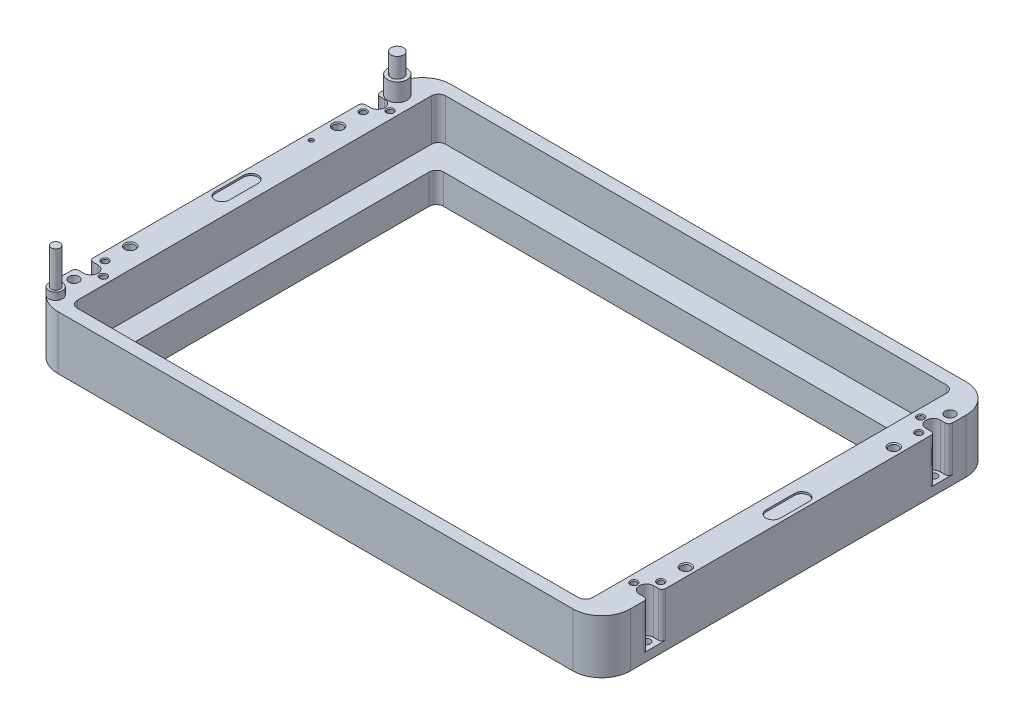
from build123d import *

# Parameters (mm, degrees)
SKETCH1_W                       = 159.7
SKETCH1_H                       = 109.7
SKETCH1_W_2                     = 130.9
SKETCH1_H_2                     = 88.7
BOSS_EXTRUDE1_DEPTH             = 20
SKETCH2_W                       = 143.7
SKETCH2_H                       = 102.7
SKETCH2_W_2                     = 130.9
SKETCH2_H_2                     = 88.7
CUT_EXTRUDE1_DEPTH              = 11.7
SKETCH3_W                       = 159.7
SKETCH3_H                       = 109.7
SKETCH3_W_2                     = 134.7
SKETCH3_H_2                     = 94.7
CUT_EXTRUDE2_DEPTH              = 5
FILLET1_R                       = 2
FILLET2_R                       = 8
M2X0_4_TAPPED_HOLE1_D           = 1.6
M2X0_4_TAPPED_HOLE1_DEPTH       = 3.5
M2X0_4_TAPPED_HOLE1_CSINK_D     = 2.05
M2X0_4_TAPPED_HOLE1_CSINK_ANGLE = 90
M2X0_4_TAPPED_HOLE1_TIP         = 0.480688495
SKETCH7_R                       = 2.7
BOSS_EXTRUDE2_DEPTH             = 5
SKETCH23_R                      = 1.75
BOSS_EXTRUDE5_DEPTH             = 5.5
SKETCH8_R                       = 1.9
BOSS_EXTRUDE3_DEPTH             = 2
SKETCH20_R                      = 1.25
BOSS_EXTRUDE4_DEPTH             = 10
CUT_EXTRUDE3_DEPTH              = 0.5
CUT_EXTRUDE4_DEPTH              = 12.5
SKETCH14_R                      = 1.1
CUT_EXTRUDE5_DEPTH              = 100.923946079
LPATTERN2_COUNT                 = 2
LPATTERN2_PITCH                 = 80
MIRROR6_COPY_1_DEPTH            = 12.5
MIRROR6_COPY_2_SKETCH_R         = 1.1
MIRROR6_COPY_2_DEPTH            = 100.923946079
MIRROR6_COPY_3_DEPTH            = 12.5
MIRROR6_COPY_4_SKETCH_R         = 1.1
MIRROR6_COPY_4_DEPTH            = 100.923946079
FILLET4_R                       = 1
M3X0_5_TAPPED_HOLE1_D           = 2.5
M3X0_5_TAPPED_HOLE1_CSINK_D     = 3.05
M3X0_5_TAPPED_HOLE1_CSINK_ANGLE = 90
SKETCH18_R                      = 0.65
CUT_EXTRUDE6_DEPTH              = 0.5
SKETCH19_R                      = 1.4
CUT_EXTRUDE7_DEPTH              = 3.5
SKETCH24_R                      = 1
CUT_EXTRUDE8_DEPTH              = 0.5


with BuildPart() as part:
    # Sketch1 → Boss-Extrude1 (new body)
    with BuildSketch(Plane(origin=(0, 0, 0), x_dir=(1, 0, 0), z_dir=(0, 1, 0))):
        Rectangle(SKETCH1_W, SKETCH1_H)
        Rectangle(SKETCH1_W_2, SKETCH1_H_2, mode=Mode.SUBTRACT)
    extrude(amount=BOSS_EXTRUDE1_DEPTH)

    # Sketch2 → Cut-Extrude1 (cut)
    with BuildSketch(Plane(origin=(0, 20, 0), x_dir=(1, 0, 0), z_dir=(0, 1, 0))):
        Rectangle(SKETCH2_W, SKETCH2_H)
        Rectangle(SKETCH2_W_2, SKETCH2_H_2, mode=Mode.SUBTRACT)
    extrude(amount=-CUT_EXTRUDE1_DEPTH, mode=Mode.SUBTRACT)

    # Sketch3 → Cut-Extrude2 (cut)
    with BuildSketch(Plane.XZ):
        Rectangle(SKETCH3_W, SKETCH3_H)
        Rectangle(SKETCH3_W_2, SKETCH3_H_2, mode=Mode.SUBTRACT)
    extrude(amount=-CUT_EXTRUDE2_DEPTH, mode=Mode.SUBTRACT)

    # Fillet1
    fillet1_edges = [part.edges().sort_by_distance(p)[0] for p in [
        (-65.45, 4.15, 44.35),
        (65.45, 4.15, 44.35),
        (65.45, 4.15, -44.35),
        (-65.45, 4.15, -44.35),
        (71.85, 14.15, 51.35),
        (-71.85, 14.15, 51.35),
        (71.85, 14.15, -51.35),
        (-71.85, 14.15, -51.35),
    ]]
    fillet(fillet1_edges, radius=FILLET1_R)

    # Fillet2
    fillet2_edges = [part.edges().sort_by_distance(p)[0] for p in [
        (-67.35, 2.5, 47.35),
        (67.35, 2.5, 47.35),
        (67.35, 2.5, -47.35),
        (-67.35, 2.5, -47.35),
        (-79.85, 12.5, 54.85),
        (79.85, 12.5, 54.85),
        (79.85, 12.5, -54.85),
        (-79.85, 12.5, -54.85),
    ]]
    fillet(fillet2_edges, radius=FILLET2_R)

    # M2x0.4 Tapped Hole1
    with Locations(Plane(origin=(0, 20, 0), x_dir=(1, 0, 0), z_dir=(0, 1, 0))):
        with Locations((-77.5, 36), (-77.5, -36), (77.5, 36), (77.5, -36), (-74, 40), (-74, -40), (74, 40), (74, -40)):
            CounterSinkHole(M2X0_4_TAPPED_HOLE1_D / 2, M2X0_4_TAPPED_HOLE1_CSINK_D / 2, depth=M2X0_4_TAPPED_HOLE1_DEPTH, counter_sink_angle=M2X0_4_TAPPED_HOLE1_CSINK_ANGLE)
            with Locations((0, 0, -(M2X0_4_TAPPED_HOLE1_DEPTH + M2X0_4_TAPPED_HOLE1_TIP / 2))):  # 118° drill point
                Cone(0, M2X0_4_TAPPED_HOLE1_D / 2, M2X0_4_TAPPED_HOLE1_TIP, mode=Mode.SUBTRACT)

    # Sketch7 → Boss-Extrude2 (add)
    with BuildSketch(Plane(origin=(0, 20, 0), x_dir=(1, 0, 0), z_dir=(0, 1, 0))):
        with Locations((-76.85, 44.85)):
            Circle(SKETCH7_R)
    extrude(amount=BOSS_EXTRUDE2_DEPTH)

    # Sketch23 → Boss-Extrude5 (add)
    with BuildSketch(Plane(origin=(0, 25, 0), x_dir=(1, 0, 0), z_dir=(0, 1, 0))):
        with Locations((-76.85, 44.85)):
            Circle(SKETCH23_R)
    extrude(amount=BOSS_EXTRUDE5_DEPTH)

    # Sketch8 → Boss-Extrude3 (add)
    with BuildSketch(Plane(origin=(0, 20, 0), x_dir=(1, 0, 0), z_dir=(0, 1, 0))):
        with Locations((-76.15, -51.15)):
            Circle(SKETCH8_R)
    extrude(amount=BOSS_EXTRUDE3_DEPTH)

    # Sketch20 → Boss-Extrude4 (add)
    with BuildSketch(Plane(origin=(0, 22, 0), x_dir=(1, 0, 0), z_dir=(0, 1, 0))):
        with Locations((-76.15, -51.15)):
            Circle(SKETCH20_R)
    extrude(amount=BOSS_EXTRUDE4_DEPTH)

    # Sketch9 → Cut-Extrude3 (cut)
    with BuildSketch(Plane(origin=(0, 20, 0), x_dir=(1, 0, 0), z_dir=(0, 1, 0))):
        with BuildLine():
            Line((-74.85, 4), (-74.85, -4))
            ThreePointArc((-74.85, -4), (-76.85, -6), (-78.85, -4))
            Line((-78.85, -4), (-78.85, 4))
            ThreePointArc((-78.85, 4), (-76.85, 6), (-74.85, 4))
        make_face()
    cut_extrude3 = extrude(amount=-CUT_EXTRUDE3_DEPTH, mode=Mode.SUBTRACT)

    # Mirror1: Cut-Extrude3 across plane
    add(cut_extrude3.mirror(Plane(origin=(0, 0, 0), x_dir=(0, 0, 1), z_dir=(1, 0, 0))), mode=Mode.SUBTRACT)

    # Sketch11 → Cut-Extrude4 (cut)
    with BuildSketch(Plane(origin=(0, 20, 0), x_dir=(1, 0, 0), z_dir=(0, 1, 0))):
        with BuildLine():
            Line((-79.85, 42), (-79.85, 38))
            Line((-79.85, 38), (-77.5, 38))
            ThreePointArc((-77.5, 38), (-75.5, 40), (-77.5, 42))
            Line((-77.5, 42), (-79.85, 42))
        make_face()
    cut_extrude4 = extrude(amount=-CUT_EXTRUDE4_DEPTH, mode=Mode.SUBTRACT)

    # Sketch14 → Cut-Extrude5 (cut, through all)
    with BuildSketch(Plane(origin=(0, 7.5, 0), x_dir=(1, 0, 0), z_dir=(0, 1, 0))):
        with Locations((-77.5, 40)):
            Circle(SKETCH14_R)
    cut_extrude5 = extrude(amount=-CUT_EXTRUDE5_DEPTH, mode=Mode.SUBTRACT)

    # LPattern2: Cut-Extrude4, Cut-Extrude5 ×2
    with Locations(*[(0, 0, i * LPATTERN2_PITCH) for i in range(1, LPATTERN2_COUNT)]):
        add(cut_extrude4, mode=Mode.SUBTRACT)
        add(cut_extrude5, mode=Mode.SUBTRACT)

    # Mirror6 copy 1 sketch → Mirror6 copy 1 (cut)
    with BuildSketch(Plane(origin=(0, 20, 80), x_dir=(-1, 0, 0), z_dir=(0, 1, 0))):
        with BuildLine():
            Line((-79.85, -42), (-79.85, -38))
            Line((-79.85, -38), (-77.5, -38))
            ThreePointArc((-77.5, -38), (-75.5, -40), (-77.5, -42))
            Line((-77.5, -42), (-79.85, -42))
        make_face()
    extrude(amount=-MIRROR6_COPY_1_DEPTH, mode=Mode.SUBTRACT)

    # Mirror6 copy 2 sketch → Mirror6 copy 2 (cut, through all)
    with BuildSketch(Plane(origin=(0, 7.5, 80), x_dir=(-1, 0, 0), z_dir=(0, 1, 0))):
        with Locations((-77.5, -40)):
            Circle(MIRROR6_COPY_2_SKETCH_R)
    extrude(amount=-MIRROR6_COPY_2_DEPTH, mode=Mode.SUBTRACT)

    # Mirror6 copy 3 sketch → Mirror6 copy 3 (cut)
    with BuildSketch(Plane(origin=(0, 20, 0), x_dir=(-1, 0, 0), z_dir=(0, 1, 0))):
        with BuildLine():
            Line((-79.85, -42), (-79.85, -38))
            Line((-79.85, -38), (-77.5, -38))
            ThreePointArc((-77.5, -38), (-75.5, -40), (-77.5, -42))
            Line((-77.5, -42), (-79.85, -42))
        make_face()
    extrude(amount=-MIRROR6_COPY_3_DEPTH, mode=Mode.SUBTRACT)

    # Mirror6 copy 4 sketch → Mirror6 copy 4 (cut, through all)
    with BuildSketch(Plane(origin=(0, 7.5, 0), x_dir=(-1, 0, 0), z_dir=(0, 1, 0))):
        with Locations((-77.5, -40)):
            Circle(MIRROR6_COPY_4_SKETCH_R)
    extrude(amount=-MIRROR6_COPY_4_DEPTH, mode=Mode.SUBTRACT)

    # Fillet4
    fillet4_edges = [part.edges().sort_by_distance(p)[0] for p in [
        (-79.85, 13.75, 42),
        (-79.85, 13.75, 38),
        (79.85, 13.75, 42),
        (79.85, 13.75, 38),
        (79.85, 13.75, -38),
        (79.85, 13.75, -42),
        (-79.85, 13.75, -38),
        (-79.85, 13.75, -42),
    ]]
    fillet(fillet4_edges, radius=FILLET4_R)

    # M3x0.5 Tapped Hole1 (through all)
    with Locations(Plane(origin=(0, 20, 0), x_dir=(1, 0, 0), z_dir=(0, 1, 0))):
        with Locations((-77.5, 29), (-77.5, -29), (77.5, 29), (77.5, -29)):
            CounterSinkHole(M3X0_5_TAPPED_HOLE1_D / 2, M3X0_5_TAPPED_HOLE1_CSINK_D / 2, counter_sink_angle=M3X0_5_TAPPED_HOLE1_CSINK_ANGLE)

    # Sketch18 → Cut-Extrude6 (cut)
    with BuildSketch(Plane(origin=(0, 20, 0), x_dir=(1, 0, 0), z_dir=(0, 1, 0))):
        with Locations((-77.85, 21.85)):
            Circle(SKETCH18_R)
    extrude(amount=-CUT_EXTRUDE6_DEPTH, mode=Mode.SUBTRACT)

    # Sketch19 → Cut-Extrude7 (cut)
    with BuildSketch(Plane(origin=(0, 20, 0), x_dir=(1, 0, 0), z_dir=(0, 1, 0))):
        with Locations((77.35, 44.85)):
            Circle(SKETCH19_R)
        with Locations((-77.35, -44.85)):
            Circle(SKETCH19_R)
    extrude(amount=-CUT_EXTRUDE7_DEPTH, mode=Mode.SUBTRACT)

    # Sketch24 → Cut-Extrude8 (cut)
    with BuildSketch(Plane(origin=(0, 8.3, 0), x_dir=(1, 0, 0), z_dir=(0, 1, 0))):
        with Locations((68.45, -17.35)):
            Circle(SKETCH24_R)
    extrude(amount=-CUT_EXTRUDE8_DEPTH, mode=Mode.SUBTRACT)


solid = part.part
